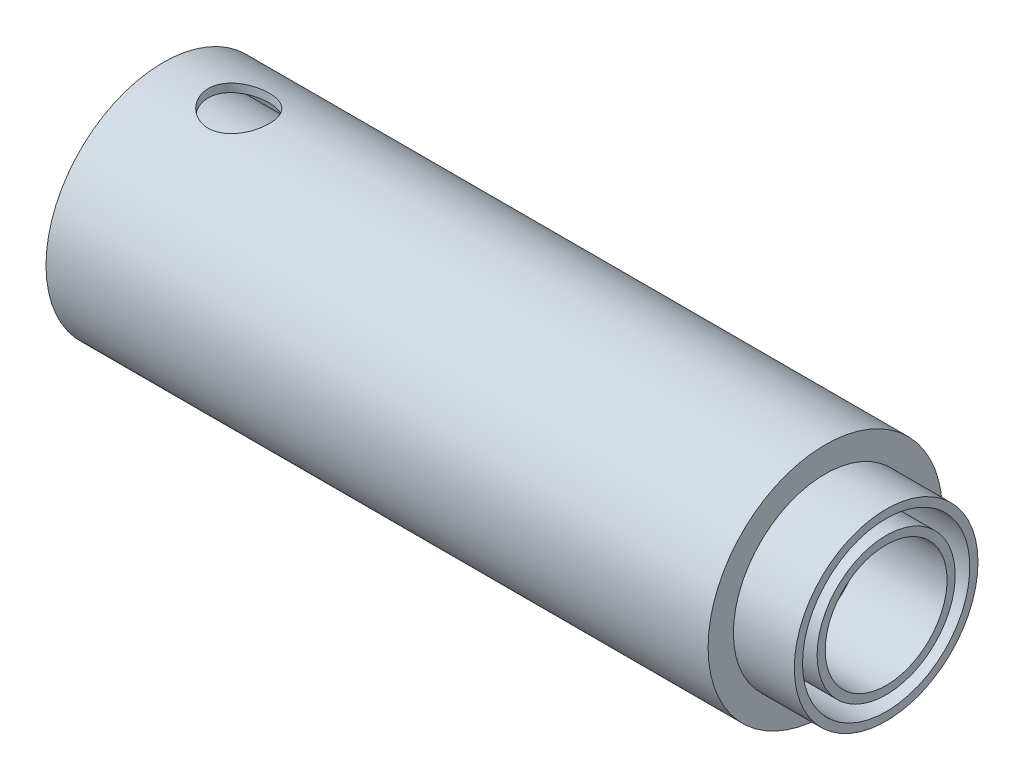
from build123d import *

# Parameters (mm, degrees)
SKETCH9_R           = 9.525
CUT_EXTRUDE9_DEPTH  = 5.842
CUT_EXTRUDE10_START = 15.24
SKETCH10_R          = 9.525
CUT_EXTRUDE10_DEPTH = 15.24


with BuildPart() as part:
    # Sketch2 → Revolve2 (revolve)
    with BuildSketch(Plane.XY, mode=Mode.PRIVATE) as revolve2_sk:
        Polygon((0.078657589, 36.627682817), (0.078657589, 26.467682817), (19.690604477, 26.467682817), (19.690604477, 29.007682817), (5.162905757, 29.007682817), (5.162905757, 34.087682817), (19.690604477, 34.087682817), (19.690604477, 36.627682817), align=None)
        Polygon((207.088657589, 36.627682817), (19.690604477, 36.627682817), (19.690604477, 34.087682817), (204.548657589, 34.087682817), (204.548657589, 26.162), (226.138657589, 26.162), (226.138657589, 28.71633139), (207.088657589, 28.71633139), align=None)
        Polygon((19.690604477, 29.007682817), (19.690604477, 26.467682817), (199.468657589, 26.467682817), (199.468657589, 19.05), (226.138657589, 19.05), (226.138657589, 21.59), (202.008657589, 21.59), (202.008657589, 29.007682817), (127, 29.007682817), align=None)
    revolve(revolve2_sk.sketch.rotate(Axis((0, 0, 0), (1, 0, 0)), 90), axis=Axis((0, 0, 0), (1, 0, 0)))

    # Sketch9 → Cut-Extrude9 (cut)
    with BuildSketch(Plane(origin=(0, 36.627682817, 0), x_dir=(1, 0, 0), z_dir=(0, 1, 0))):
        with Locations(Location((23.718923994, 0, 0), (0, 0, 270))):
            Circle(SKETCH9_R)
    extrude(amount=-CUT_EXTRUDE9_DEPTH, mode=Mode.SUBTRACT)

    # Sketch10 → Cut-Extrude10 (cut)
    with BuildSketch(Plane(origin=(0, -36.627682817, 0), x_dir=(1, 0, 0), z_dir=(0, 1, 0)).offset(CUT_EXTRUDE10_START)):
        with Locations(Location((23.718923994, 0, 0), (0, 0, 270))):
            Circle(SKETCH10_R)
    extrude(amount=-CUT_EXTRUDE10_DEPTH, mode=Mode.SUBTRACT)


solid = part.part
